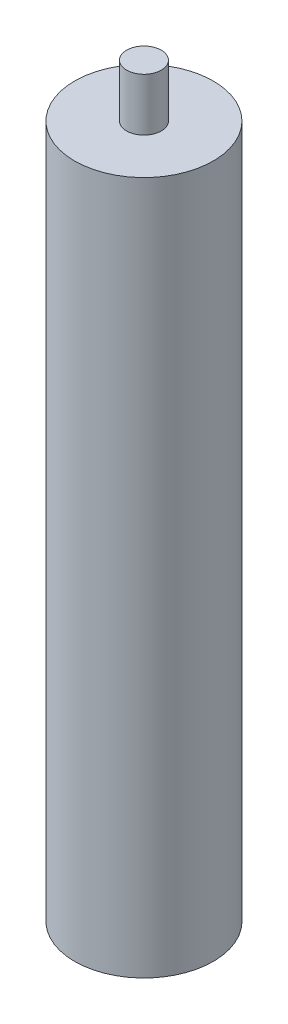
from build123d import *

# Parameters (mm, degrees)
SKETCH1_R           = 12.7
BOSS_EXTRUDE1_DEPTH = 127
SKETCH2_R           = 3.175
BOSS_EXTRUDE2_DEPTH = 9.652


with BuildPart() as part:
    # Sketch1 → Boss-Extrude1 (new body)
    with BuildSketch(Plane(origin=(0, 0, 0), x_dir=(1, 0, 0), z_dir=(0, 1, 0))):
        with Locations(Location((0, 0, 0), (0, 0, 270))):
            Circle(SKETCH1_R)
    extrude(amount=BOSS_EXTRUDE1_DEPTH)

    # Sketch2 → Boss-Extrude2 (add)
    with BuildSketch(Plane(origin=(0, 127, 0), x_dir=(1, 0, 0), z_dir=(0, 1, 0))):
        with Locations(Location((0, 0, 0), (0, 0, 270))):
            Circle(SKETCH2_R)
    extrude(amount=BOSS_EXTRUDE2_DEPTH)


solid = part.part
